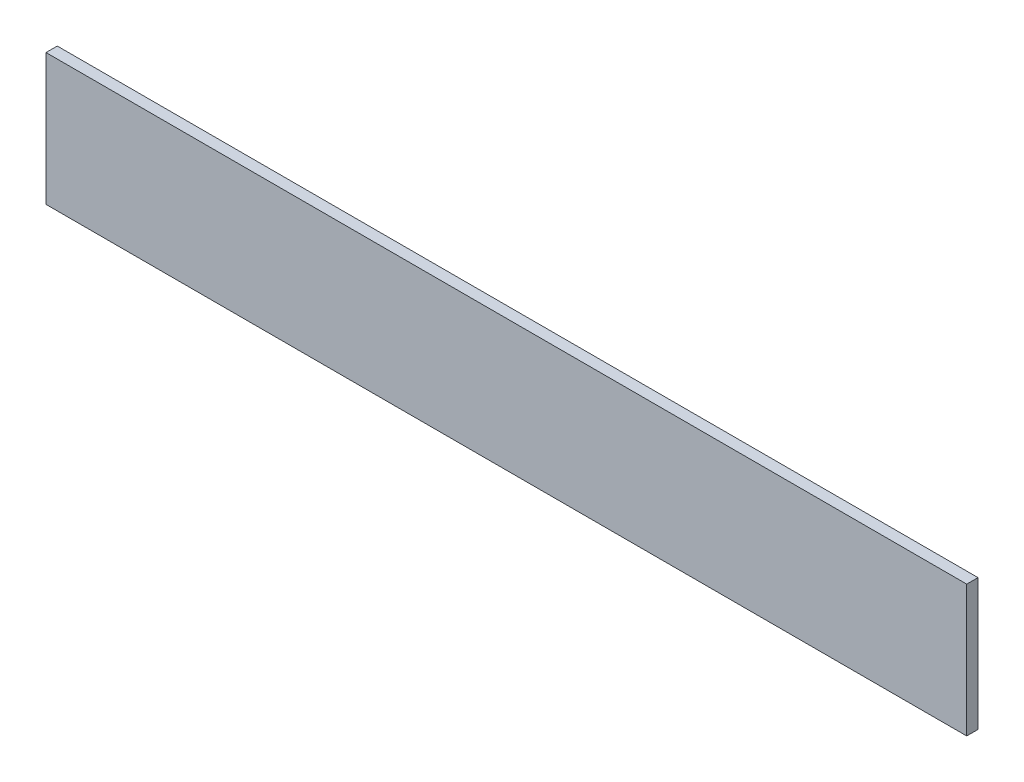
from build123d import *

# Parameters (mm, degrees)
SKETCH_1_W      = 245
SKETCH_1_H      = 35
EXTRUDE_1_DEPTH = 3


with BuildPart() as part:
    # 草图1 → 凸台-拉伸1 (new body)
    with BuildSketch(Plane.XY):
        with Locations((-122.5, -17.5)):
            Rectangle(SKETCH_1_W, SKETCH_1_H)
    extrude(amount=EXTRUDE_1_DEPTH)


solid = part.part
